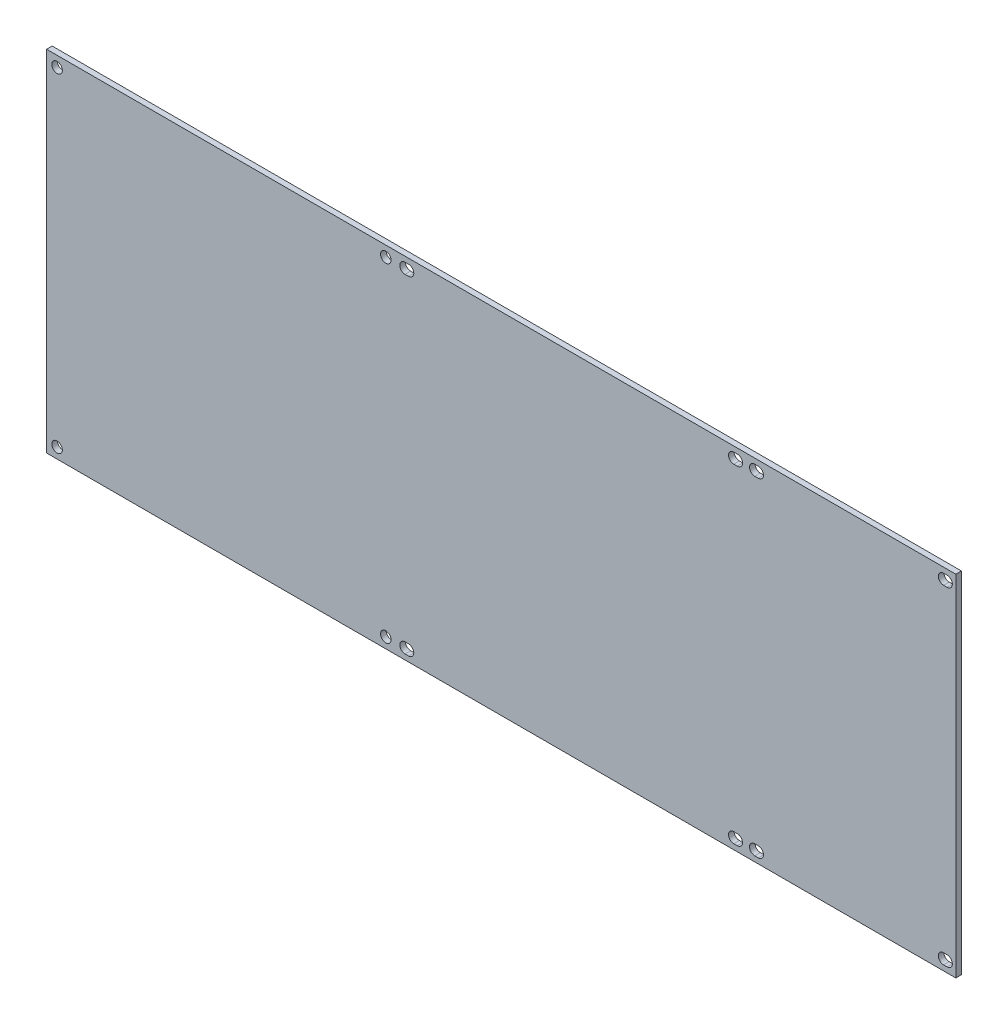
from build123d import *

# Parameters (mm, degrees)
SKETCH_1_W      = 260
SKETCH_1_H      = 100
SKETCH_1_R      = 1.5
EXTRUDE_1_DEPTH = 1.6


with BuildPart() as part:
    # 草图1 → 凸台-拉伸1 (new body)
    with BuildSketch(Plane.XY):
        with Locations((130, 50)):
            Rectangle(SKETCH_1_W, SKETCH_1_H)
        with Locations((3, 3)):
            Circle(SKETCH_1_R, mode=Mode.SUBTRACT)
        with Locations((3, 97)):
            Circle(SKETCH_1_R, mode=Mode.SUBTRACT)
        with Locations((97, 97)):
            Circle(SKETCH_1_R, mode=Mode.SUBTRACT)
        with Locations((97, 3)):
            Circle(SKETCH_1_R, mode=Mode.SUBTRACT)
        with BuildLine():
            Line((102.5, 98.5), (103.5, 98.5))
            ThreePointArc((103.5, 98.5), (105, 97), (103.5, 95.5))
            Line((103.5, 95.5), (102.5, 95.5))
            ThreePointArc((102.5, 95.5), (101, 97), (102.5, 98.5))
        make_face(mode=Mode.SUBTRACT)
        with BuildLine():
            Line((102.5, 4.5), (103.5, 4.5))
            ThreePointArc((103.5, 4.5), (105, 3), (103.5, 1.5))
            Line((103.5, 1.5), (102.5, 1.5))
            ThreePointArc((102.5, 1.5), (101, 3), (102.5, 4.5))
        make_face(mode=Mode.SUBTRACT)
        with BuildLine():
            Line((196.5, 98.5), (197.5, 98.5))
            ThreePointArc((197.5, 98.5), (199, 97), (197.5, 95.5))
            Line((197.5, 95.5), (196.5, 95.5))
            ThreePointArc((196.5, 95.5), (195, 97), (196.5, 98.5))
        make_face(mode=Mode.SUBTRACT)
        with BuildLine():
            Line((196.5, 4.5), (197.5, 4.5))
            ThreePointArc((197.5, 4.5), (199, 3), (197.5, 1.5))
            Line((197.5, 1.5), (196.5, 1.5))
            ThreePointArc((196.5, 1.5), (195, 3), (196.5, 4.5))
        make_face(mode=Mode.SUBTRACT)
        with BuildLine():
            Line((202.5, 4.5), (203.5, 4.5))
            ThreePointArc((203.5, 4.5), (205, 3), (203.5, 1.5))
            Line((203.5, 1.5), (202.5, 1.5))
            ThreePointArc((202.5, 1.5), (201, 3), (202.5, 4.5))
        make_face(mode=Mode.SUBTRACT)
        with BuildLine():
            Line((202.5, 98.5), (203.5, 98.5))
            ThreePointArc((203.5, 98.5), (205, 97), (203.5, 95.5))
            Line((203.5, 95.5), (202.5, 95.5))
            ThreePointArc((202.5, 95.5), (201, 97), (202.5, 98.5))
        make_face(mode=Mode.SUBTRACT)
        with BuildLine():
            Line((257.5, 95.5), (256.5, 95.5))
            ThreePointArc((256.5, 95.5), (255, 97), (256.5, 98.5))
            Line((256.5, 98.5), (257.5, 98.5))
            ThreePointArc((257.5, 98.5), (259, 97), (257.5, 95.5))
        make_face(mode=Mode.SUBTRACT)
        with BuildLine():
            Line((257.5, 1.5), (256.5, 1.5))
            ThreePointArc((256.5, 1.5), (255, 3), (256.5, 4.5))
            Line((256.5, 4.5), (257.5, 4.5))
            ThreePointArc((257.5, 4.5), (259, 3), (257.5, 1.5))
        make_face(mode=Mode.SUBTRACT)
    extrude(amount=EXTRUDE_1_DEPTH)


solid = part.part
